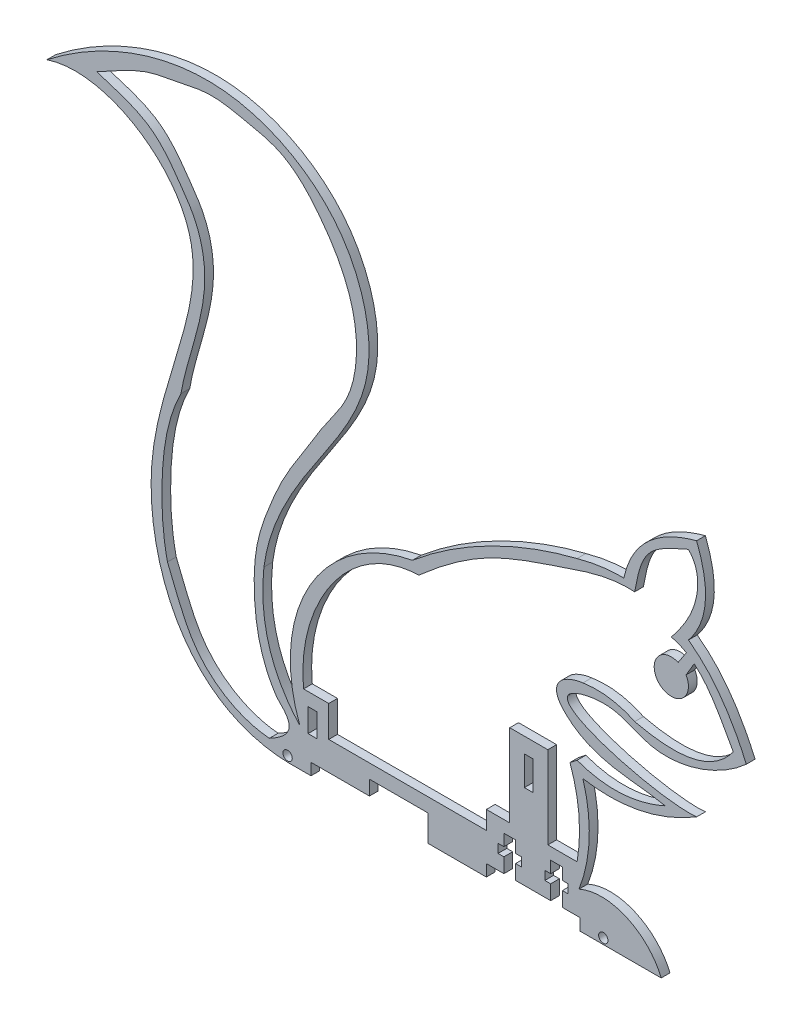
from build123d import *

# Parameters (mm, degrees)
SKETCH_1_R      = 1.6
SKETCH_1_R_2    = 1.600000009
SKETCH_1_W      = 3
SKETCH_1_H      = 8
EXTRUDE_1_DEPTH = 3


with BuildPart() as part:
    # 草图1 → 凸台-拉伸1 (new body)
    with BuildSketch(Plane.XY):
        with BuildLine():
            Line((146.000000814, -2.351e-06), (140.000000814, -2.351e-06))
            Line((140.000000814, -2.351e-06), (140.000000814, 4.999997649))
            Line((140.000000814, 4.999997649), (142.000000814, 4.999997649))
            Line((142.000000814, 4.999997649), (142.000000814, 7.999997649))
            Line((142.000000814, 7.999997649), (140.000000814, 7.99999765))
            Line((140.000000814, 7.99999765), (140.000000814, 11.999997649))
            Line((140.000000814, 11.999997649), (136.000000814, 11.999997649))
            Line((136.000000814, 11.999997649), (136.000000814, 7.99999765))
            Line((136.000000814, 7.99999765), (134.000000814, 7.999997649))
            Line((134.000000814, 7.999997649), (134.000000814, 4.999997649))
            Line((134.000000814, 4.999997649), (136.000000814, 4.999997649))
            Line((136.000000814, 4.999997649), (136.000000814, -2.351e-06))
            Line((136.000000814, -2.351e-06), (123.999999977, -2.351e-06))
            Line((123.999999977, -2.351e-06), (123.999999977, 4.999997649))
            Line((123.999999977, 4.999997649), (125.999999977, 4.999997649))
            Line((125.999999977, 4.999997649), (125.999999977, 7.999997649))
            Line((125.999999977, 7.999997649), (123.999999977, 7.99999765))
            Line((123.999999977, 7.99999765), (123.999999977, 11.999997649))
            Line((123.999999977, 11.999997649), (119.999999977, 11.999997649))
            Line((119.999999977, 11.999997649), (119.999999977, 7.99999765))
            Line((119.999999977, 7.99999765), (117.999999977, 7.999997649))
            Line((117.999999977, 7.999997649), (117.999999977, 4.999997649))
            Line((117.999999977, 4.999997649), (119.999999977, 4.999997649))
            Line((119.999999977, 4.999997649), (119.999999977, -2.351e-06))
            Line((119.999999977, -2.351e-06), (113.999999977, -2.351e-06))
            Line((113.999999977, -2.351e-06), (113.999999977, -4.000002351))
            Line((113.999999977, -4.000002351), (93.999999977, -4.000002351))
            Line((93.999999977, -4.000002351), (93.999999977, 4.999997649))
            Line((93.999999977, 4.999997649), (73.999999977, 4.999998866))
            Line((73.999999977, 4.999998866), (73.999999977, 0))
            Line((73.999999977, 0), (53.999999977, 0))
            Line((53.999999977, 0), (53.999999977, -4.000002351))
            Line((53.999999977, -4.000002351), (46.08762105, -4.000002351))
            add(Edge.make_bspline(
                [(-36.328351114, 162.981926911), (-16.985097945, 169.429178788), (20.272979731, 146.34512069), (9.135892142, 98.516125938), (-9.297347109, 48.395895966), (11.087251884, -2.833428325), (46.08762105, -4.000002351)],
                knots=[0, 0, 0, 0, 0.267965524, 0.416050174, 0.610524941, 1, 1, 1, 1], degree=3))
            add(Edge.make_bspline(
                [(-36.328351114, 162.981926911), (-19.212605279, 176.393074807), (18.672630794, 193.512400891), (67.347976372, 167.686369959), (79.549282406, 122.097112344), (55.563999492, 90.926863056), (41.467559873, 66.468884892), (38.375976124, 53.451041954), (37.893772805, 49.792065307)],
                knots=[0, 0, 0, 0, 0.268932398, 0.436076908, 0.592250976, 0.761710351, 0.880208, 0.924853484, 0.924853484, 0.924853484, 0.924853484], degree=3))
            add(Edge.make_bspline(
                [(37.893772805, 49.792065307), (36.188264686, 33.287411379), (40.277199836, 19.704159891), (50.160578254, 9.042310843)],
                knots=[0, 0, 0, 0, 0.573192318, 0.573192318, 0.573192318, 0.573192318], degree=3))
            ThreePointArc((50.160578254, 9.042310843), (53.555511196, 52.09671049), (88.699667478, 77.198407204))
            add(Edge.make_bspline(
                [(88.699667478, 77.198407204), (105.069584697, 91.014186945), (125.08819759, 100.936112364), (145.032460118, 105.870213559)],
                knots=[0.574998224, 0.574998224, 0.574998224, 0.574998224, 1, 1, 1, 1], degree=3))
            add(Edge.make_bspline(
                [(145.032460118, 105.870213559), (153.513112826, 108.235412429), (161.032687623, 108.083161053)],
                knots=[0, 0, 0, 0.216188604, 0.216188604, 0.216188604], degree=2))
            add(Edge.make_bspline(
                [(161.032687623, 108.083161053), (163.505439553, 119.989132355), (171.801790989, 127.828018989), (185.921743601, 131.599820923)],
                knots=[0.193710005, 0.193710005, 0.193710005, 0.193710005, 1, 1, 1, 1], degree=3))
            add(Edge.make_bspline(
                [(185.921743601, 131.599820923), (190.784688072, 119.237712596), (189.855300178, 108.970196407), (183.13357926, 100.797272831)],
                knots=[0, 0, 0, 0, 0.750226213, 0.750226213, 0.750226213, 0.750226213], degree=3))
            add(Edge.make_bspline(
                [(183.13357926, 100.797272831), (194.920485534, 92.295921303), (202.92520802, 73.887506676)],
                knots=[0.571130844, 0.571130844, 0.571130844, 1, 1, 1], degree=2))
            add(Edge.make_bspline(
                [(202.92520802, 73.887506676), (194.67804276, 66.306338448), (175.161420749, 58.104899882), (157.451970937, 69.396569277), (123.73837201, 61.528468102), (173.306787435, 48.479763228), (185.921743601, 49.792065307)],
                knots=[0, 0, 0, 0, 0.328040803, 0.450973878, 0.579787893, 1, 1, 1, 1], degree=3))
            add(Edge.make_bspline(
                [(147.032656556, 41.686330301), (160.313517728, 39.442306564), (173.276546743, 42.144218232), (185.921743601, 49.792065307)],
                knots=[0.296717255, 0.296717255, 0.296717255, 0.296717255, 1, 1, 1, 1], degree=3))
            ThreePointArc((147.032656556, 41.686330301), (149.167762406, 24.865699568), (145.685621904, 8.271514057))
            add(Edge.make_bspline(
                [(145.685621904, 8.271514057), (156.758942687, 13.153444732), (169.587636633, 6.433891588), (173.806591844, -4.000002351)],
                knots=[0, 0, 0, 0, 1, 1, 1, 1], degree=3))
            Line((173.806591844, -4.000002351), (146.000000814, -4.000002351))
            Line((146.000000814, -4.000002351), (146.000000814, -2.351e-06))
        make_face()
        with Locations((154.000000579, -2.000002061)):
            Circle(SKETCH_1_R, mode=Mode.SUBTRACT)
        with Locations((46.000000001, -1.999999674)):
            Circle(SKETCH_1_R_2, mode=Mode.SUBTRACT)
        with BuildLine():
            Line((51.451518273, 20.470101797), (60.076208852, 20.470101797))
            Line((60.076208852, 20.470101797), (60.076208852, 9.816072259))
            Line((60.076208852, 9.816072259), (113.999999977, 9.816072259))
            Line((113.999999977, 9.816072259), (113.999999977, 16.04055611))
            Line((113.999999977, 16.04055611), (121.999999977, 16.04055611))
            Line((121.999999977, 16.04055611), (121.999999977, 44.250166338))
            Line((121.999999977, 44.250166338), (135.034915791, 44.250166338))
            Line((135.034915791, 44.250166338), (135.034915791, 16.04055611))
            Line((135.034915791, 16.04055611), (145.032460118, 16.04055611))
            add(Edge.make_bspline(
                [(142.603393773, 44.250166338), (147.526750549, 30.459255751), (145.032460118, 16.04055611)],
                knots=[0, 0, 0, 1, 1, 1], degree=2))
            Line((142.603393773, 44.250166338), (145.032460118, 46.117573034))
            add(Edge.make_bspline(
                [(145.032460118, 46.117573034), (159.765331973, 40.733000292), (175.176199018, 47.698224186)],
                knots=[0, 0, 0, 1, 1, 1], degree=2))
            add(Edge.make_bspline(
                [(175.176199018, 47.698224186), (164.141155333, 50.024987749), (147.760775089, 48.329708919), (135.760771477, 63.723026479), (140.000000814, 67.409996421)],
                knots=[0, 0, 0, 0, 0.72835849, 1, 1, 1, 1], degree=3))
            add(Edge.make_bspline(
                [(140.000000814, 67.409996421), (141.943435941, 68.885356719), (144.646069701, 69.727810862), (147.032656556, 70.042108212)],
                knots=[0, 0, 0, 0, 0.12141787, 0.12141787, 0.12141787, 0.12141787], degree=3))
            add(Edge.make_bspline(
                [(147.032656556, 70.042108212), (156.30763716, 71.469425061), (164.731316957, 67.409996421)],
                knots=[0, 0, 0, 1, 1, 1], degree=2))
            add(Edge.make_bspline(
                [(164.731316957, 67.409996421), (177.139289233, 64.564420748), (190.264588085, 64.152548316), (198.474981518, 75.322517317)],
                knots=[0.41074201, 0.41074201, 0.41074201, 0.41074201, 1, 1, 1, 1], degree=3))
            add(Edge.make_bspline(
                [(185.103153591, 94.759702543), (191.098486191, 89.762778463), (194.820698548, 81.554201533), (198.474981518, 75.322517317)],
                knots=[0.272966812, 0.272966812, 0.272966812, 0.272966812, 1, 1, 1, 1], degree=3))
            Line((185.103153591, 94.759702543), (182.299569864, 90.029408179))
            ThreePointArc((182.299569864, 90.029408179), (173.404046675, 82.612253299), (179.612489769, 92.389765952))
            Line((179.612489769, 92.389765952), (182.415662425, 96.671092948))
            add(Edge.make_bspline(
                [(177.272253905, 98.755234122), (180.06602998, 98.060170063), (182.415662425, 96.671092948)],
                knots=[0, 0, 0, 0.170127639, 0.170127639, 0.170127639], degree=2))
            add(Edge.make_bspline(
                [(183.13357926, 127.660371238), (186.388901551, 124.29801059), (187.248253912, 112.881099328), (181.16942725, 103.538995792), (177.272253905, 98.755234122)],
                knots=[0, 0, 0, 0, 0.411386604, 1, 1, 1, 1], degree=3))
            add(Edge.make_bspline(
                [(164.731316957, 105.870213559), (165.579240961, 110.321174129), (167.380783973, 121.721585243), (178.534709472, 125.475378959), (183.13357926, 127.660371238)],
                knots=[0, 0, 0, 0, 0.468747509, 1, 1, 1, 1], degree=3))
            add(Edge.make_bspline(
                [(90.881261911, 73.887506676), (98.412041567, 80.527419506), (113.653406911, 92.201377123), (139.792845663, 100.570138786), (156.023510701, 106.389201519), (164.731316957, 105.870213559)],
                knots=[0, 0, 0, 0, 0.369785284, 0.690054547, 1, 1, 1, 1], degree=3))
            add(Edge.make_bspline(
                [(51.451518273, 20.470101797), (50.489586181, 30.513732415), (55.55804085, 55.245004243), (75.572906955, 73.396423686), (90.881261911, 73.887506676)],
                knots=[0, 0, 0, 0, 0.412378202, 1, 1, 1, 1], degree=3))
        make_face(mode=Mode.SUBTRACT)
        Polygon((130.000000395, 31.999997649), (130.000000395, 38.999997649), (127.000000395, 38.999997649), (127.000000395, 28.999997649), (130.000000395, 28.999997649), align=None, mode=Mode.SUBTRACT)
        with Locations((54.499999982, 11.999998989)):
            Rectangle(SKETCH_1_W, SKETCH_1_H, mode=Mode.SUBTRACT)
        with BuildLine():
            add(Edge.make_bspline(
                [(-19.25560447, 167.961018402), (-12.985744942, 165.914268895), (-0.510939815, 162.830752158), (8.111381979, 150.578818422), (15.1143708, 140.63314777), (21.029155415, 119.249629572), (11.788274922, 100.499770018), (9.537929047, 87.015900395)],
                knots=[0, 0, 0, 0, 0.204134596, 0.357425398, 0.435141456, 0.570450798, 1, 1, 1, 1], degree=3))
            add(Edge.make_bspline(
                [(9.537929047, 87.015900395), (4.72171283, 77.572648661), (2.216959909, 59.751523956), (3.305764606, 41.981925331), (4.909911596, 34.808548106)],
                knots=[0, 0, 0, 0, 0.295349573, 0.502012775, 0.502012775, 0.502012775, 0.502012775], degree=3))
            add(Edge.make_bspline(
                [(4.909911596, 34.808548106), (7.962271928, 27.73283555), (13.379038095, 10.161804414), (30.181776246, 0.771258644), (39.772918478, 0)],
                knots=[0, 0, 0, 0, 0.453956207, 1, 1, 1, 1], degree=3))
            add(Edge.make_bspline(
                [(42.280473116, 13.46568189), (46.599976147, 9.234382953), (50.155575705, 5.464479896), (39.772918478, 0)],
                knots=[0.928992033, 0.928992033, 0.928992033, 0.928992033, 1, 1, 1, 1], degree=3))
            add(Edge.make_bspline(
                [(-19.25560447, 167.961018402), (-13.197866885, 171.116352979), (-4.509931733, 176.751701246), (8.908740952, 178.680936261), (19.723089093, 181.451354957), (31.544757156, 178.806773782), (46.045243776, 175.875154186), (56.041185545, 165.133329857), (63.859310516, 153.49896678), (68.677116942, 142.032516888), (70.336392872, 128.027237021), (67.43864229, 113.818199307), (59.027553713, 103.225671363), (52.401388482, 91.913320762), (45.300641185, 81.451361059), (39.637303867, 68.651834704), (34.956753709, 56.010059063), (34.004307464, 36.344139985), (36.617316077, 21.730947854), (42.280473116, 13.46568189)],
                knots=[0, 0, 0, 0, 0.084550445, 0.121132484, 0.164743283, 0.218456627, 0.266343985, 0.342105399, 0.387006441, 0.438418171, 0.491501782, 0.557393562, 0.608145716, 0.654396635, 0.717407728, 0.761562844, 0.824888535, 0.8799568, 1, 1, 1, 1], degree=3))
        make_face(mode=Mode.SUBTRACT)
    extrude(amount=EXTRUDE_1_DEPTH)


solid = part.part
